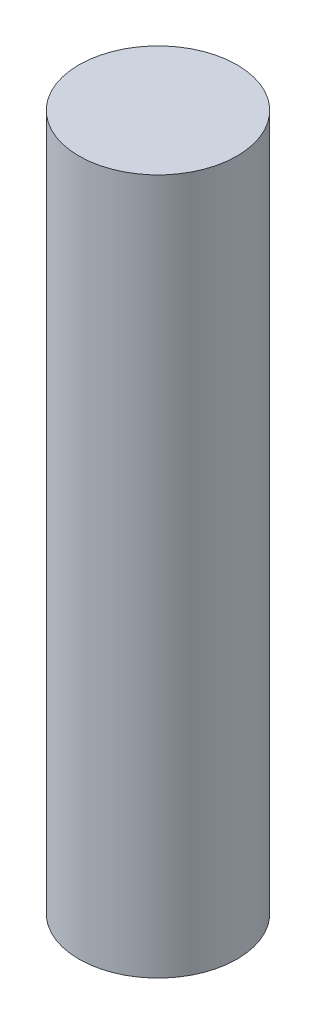
from build123d import *

# Parameters (mm, degrees)
SKETCH1_R           = 5
BOSS_EXTRUDE1_DEPTH = 44


with BuildPart() as part:
    # Sketch1 → Boss-Extrude1 (new body)
    with BuildSketch(Plane(origin=(0, 0, 0), x_dir=(1, 0, 0), z_dir=(0, 1, 0))):
        with Locations(Location((0, 0, 0), (0, 0, 270))):
            Circle(SKETCH1_R)
    extrude(amount=BOSS_EXTRUDE1_DEPTH)


solid = part.part
